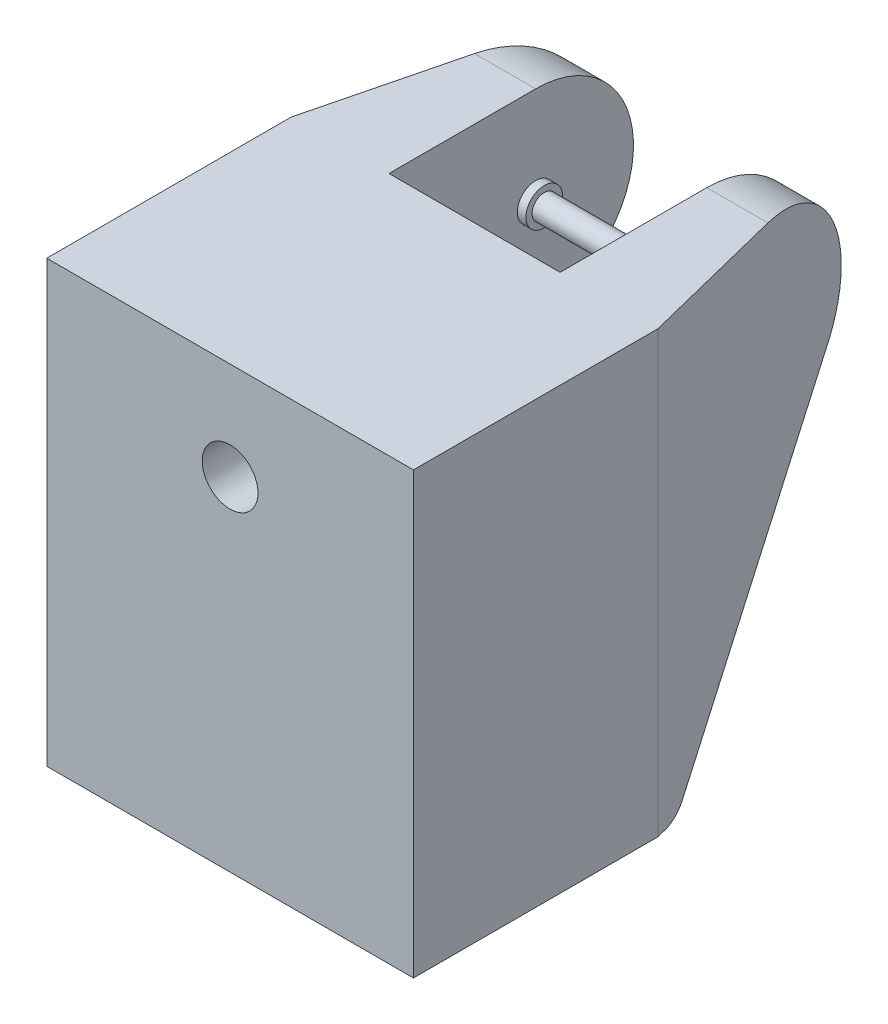
from build123d import *

# Parameters (mm, degrees)
SKETCH1_W            = 150
SKETCH1_H            = 180
BOSS_EXTRUDE1_DEPTH  = 110
SKETCH2_W            = 35
SKETCH2_H            = 10
CUT_EXTRUDE1_DEPTH   = 228
BOSS_EXTRUDE2_DEPTH  = 40
SKETCH5_R            = 40
SKETCH5_R_2          = 5
BOSS_EXTRUDE3_DEPTH  = 40
BOSS_EXTRUDE5_DEPTH  = 40
CUT_EXTRUDE2_DEPTH   = 40
BOSS_EXTRUDE6_DEPTH  = 40
CUT_EXTRUDE3_START   = -40
CUT_EXTRUDE3_DEPTH   = 40
BOSS_EXTRUDE7_START  = -30
SKETCH11_R           = 5
BOSS_EXTRUDE7_DEPTH  = 30
SKETCH12_R           = 5
BOSS_EXTRUDE8_DEPTH  = 30
CUT_EXTRUDE4_DEPTH   = 187
BOSS_EXTRUDE9_START  = 90
SKETCH16_R           = 5
BOSS_EXTRUDE9_DEPTH  = 90
BOSS_EXTRUDE10_START = 3.5
SKETCH17_R           = 7.5
SKETCH17_R_2         = 5
BOSS_EXTRUDE10_DEPTH = 3.5
SKETCH18_R           = 7.5
SKETCH18_R_2         = 5
BOSS_EXTRUDE11_DEPTH = 3.5
SKETCH20_R           = 11.405
CUT_EXTRUDE5_DEPTH   = 20


with BuildPart() as part:
    # Sketch1 → Boss-Extrude1 (new body)
    with BuildSketch(Plane.XY):
        Rectangle(SKETCH1_W, SKETCH1_H)
    extrude(amount=BOSS_EXTRUDE1_DEPTH)

    # Sketch2 → Cut-Extrude1 (cut)
    with BuildSketch(Plane(origin=(0, 90, 0), x_dir=(1, 0, 0), z_dir=(0, 1, 0))):
        with Locations((17.5, -5)):
            Rectangle(SKETCH2_W, SKETCH2_H)
        with Locations((-17.5, -5)):
            Rectangle(SKETCH2_W, SKETCH2_H)
    extrude(amount=-CUT_EXTRUDE1_DEPTH, mode=Mode.SUBTRACT)

    # Sketch3 → Boss-Extrude2 (add)
    with BuildSketch(Plane(origin=(-35, 0, 0), x_dir=(0, 0, -1), z_dir=(1, 0, 0))):
        with BuildLine():
            Line((50, 90), (0, 90))
            Line((0, 90), (0, 50))
            Line((0, 50), (10, 50))
            ThreePointArc((10, 50), (21.715728753, 78.284271247), (50, 90))
        make_face()
        with BuildLine():
            Line((10, 50), (0, 50))
            Line((0, 50), (0, -85.77))
            Line((0, -85.77), (2.99, -85.77))
            Line((2.99, -85.77), (82.660422477, 26.906780138))
            ThreePointArc((82.660422477, 26.906780138), (37.884243711, 11.879028743), (10, 50))
        make_face()
        with BuildLine():
            ThreePointArc((90, 50), (78.284271247, 78.284271247), (50, 90))
            Line((50, 90), (50, 55))
            ThreePointArc((50, 55), (53.535533906, 53.535533906), (55, 50))
            ThreePointArc((55, 50), (50, 45), (45, 50))
            Line((45, 50), (10, 50))
            ThreePointArc((10, 50), (37.884243711, 11.879028743), (82.660422477, 26.906780138))
            ThreePointArc((82.660422477, 26.906780138), (88.120971257, 37.884243711), (90, 50))
        make_face()
        with BuildLine():
            Line((50, 55), (50, 90))
            ThreePointArc((50, 90), (21.715728753, 78.284271247), (10, 50))
            Line((10, 50), (45, 50))
            ThreePointArc((45, 50), (46.464466094, 53.535533906), (50, 55))
        make_face()
    extrude(amount=-BOSS_EXTRUDE2_DEPTH)

    # Sketch5 → Boss-Extrude3 (add)
    # profile 1 of 2: a face of its own
    with BuildSketch(Plane(origin=(75, 0, 0), x_dir=(0, 0, -1), z_dir=(1, 0, 0))):
        with BuildLine():
            Line((50, 90), (0, 90))
            Line((0, 90), (0, -85.77))
            Line((0, -85.77), (2.99, -85.77))
            Line((2.99, -85.77), (82.660422477, 26.906780138))
            ThreePointArc((82.660422477, 26.906780138), (14.477269288, 31.61153615), (50, 90))
        make_face()
    # profile 2 of 2: a face of its own
    with BuildSketch(Plane(origin=(75, 0, 0), x_dir=(0, 0, -1), z_dir=(1, 0, 0))):
        with Locations((50, 50)):
            Circle(SKETCH5_R)
        with Locations((50, 50)):
            Circle(SKETCH5_R_2, mode=Mode.SUBTRACT)
    extrude(amount=-BOSS_EXTRUDE3_DEPTH)

    # Sketch6 → Boss-Extrude5 (add)
    with BuildSketch(Plane(origin=(75, 0, 0), x_dir=(0, 0, -1), z_dir=(1, 0, 0))):
        Polygon((2.99, -85.77), (0, -90), (0, -85.77), align=None)
    extrude(amount=-BOSS_EXTRUDE5_DEPTH)

    # Sketch8 → Cut-Extrude2 (cut)
    with BuildSketch(Plane.ZY.offset(-35)):
        with BuildLine():
            Line((0, -90), (5.18, -90))
            ThreePointArc((5.18, -90), (0.670947119, -88.704033579), (-2.99, -85.77))
            Line((-2.99, -85.77), (0, -90))
        make_face()
    extrude(amount=-CUT_EXTRUDE2_DEPTH, mode=Mode.SUBTRACT)

    # Sketch9 → Boss-Extrude6 (add)
    with BuildSketch(Plane.ZY.offset(75)):
        Polygon((-2.99, -85.77), (0, -90), (0, -85.77), align=None)
    extrude(amount=-BOSS_EXTRUDE6_DEPTH)

    # Sketch10 → Cut-Extrude3 (cut)
    with BuildSketch(Plane(origin=(-35, 0, 0), x_dir=(0, 0, -1), z_dir=(1, 0, 0)).offset(CUT_EXTRUDE3_START)):
        with BuildLine():
            Line((-5.18, -90), (0, -90))
            Line((0, -90), (2.99, -85.77))
            ThreePointArc((2.99, -85.77), (-0.670947119, -88.704033579), (-5.18, -90))
        make_face()
    extrude(amount=CUT_EXTRUDE3_DEPTH, mode=Mode.SUBTRACT)

    # Sketch11 → Boss-Extrude7 (add)
    with BuildSketch(Plane.ZY.offset(75).offset(BOSS_EXTRUDE7_START)):
        with Locations(Location((-50, 50, 0), (0, 0, 180))):
            Circle(SKETCH11_R)
    extrude(amount=BOSS_EXTRUDE7_DEPTH)

    # Sketch12 → Boss-Extrude8 (add)
    with BuildSketch(Plane(origin=(75, 0, 0), x_dir=(0, 0, -1), z_dir=(1, 0, 0))):
        with Locations((50, 50)):
            Circle(SKETCH12_R)
    extrude(amount=-BOSS_EXTRUDE8_DEPTH)

    # Sketch14 → Cut-Extrude4 (cut)
    with BuildSketch(Plane(origin=(0, 90, 0), x_dir=(1, 0, 0), z_dir=(0, 1, 0))):
        Polygon((-60, 50), (-50, 90), (-75, 90), (-75, 50), align=None)
        Polygon((-75, -10), (-60, 50), (-75, 50), (-75, 0), align=None)
        Polygon((60, 50), (75, -10), (75, 0), (75, 50), align=None)
        Polygon((50, 90), (60, 50), (75, 50), (75, 90), align=None)
    extrude(amount=-CUT_EXTRUDE4_DEPTH, mode=Mode.SUBTRACT)

    # Sketch16 → Boss-Extrude9 (add)
    with BuildSketch(Plane(origin=(-45, 0, 0), x_dir=(0, 0, -1), z_dir=(1, 0, 0)).offset(BOSS_EXTRUDE9_START)):
        with Locations((50, 50)):
            Circle(SKETCH16_R)
    extrude(amount=-BOSS_EXTRUDE9_DEPTH)

    # Sketch17 → Boss-Extrude10 (add)
    with BuildSketch(Plane(origin=(-35, 0, 0), x_dir=(0, 0, -1), z_dir=(1, 0, 0)).offset(BOSS_EXTRUDE10_START)):
        with Locations((50, 50)):
            Circle(SKETCH17_R)
        with Locations((50, 50)):
            Circle(SKETCH17_R_2, mode=Mode.SUBTRACT)
    extrude(amount=-BOSS_EXTRUDE10_DEPTH)

    # Sketch18 → Boss-Extrude11 (add)
    with BuildSketch(Plane.ZY.offset(-35)):
        with Locations(Location((-50, 50, 0), (0, 0, 180))):
            Circle(SKETCH18_R)
        with Locations((-50, 50)):
            Circle(SKETCH18_R_2, mode=Mode.SUBTRACT)
    extrude(amount=BOSS_EXTRUDE11_DEPTH)

    # Sketch20 → Cut-Extrude5 (cut)
    with BuildSketch(Plane.XY.offset(110)):
        with Locations((0, 50)):
            Circle(SKETCH20_R)
    extrude(amount=-CUT_EXTRUDE5_DEPTH, mode=Mode.SUBTRACT)


solid = part.part
